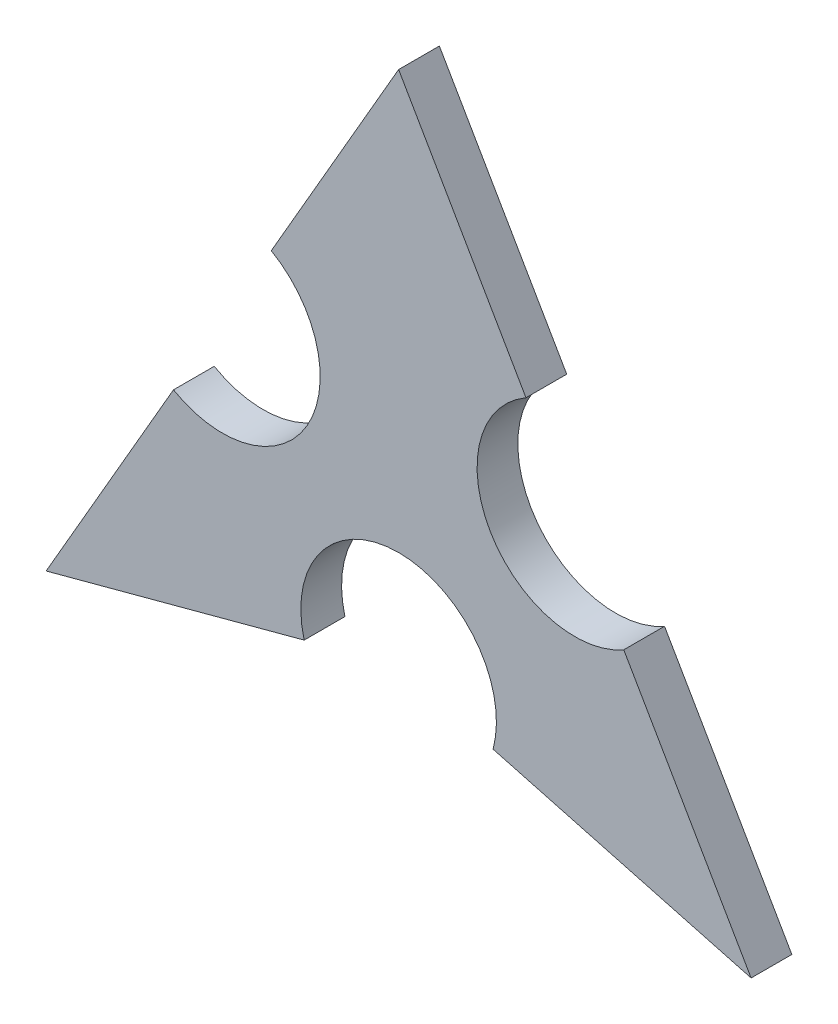
from build123d import *

# Parameters (mm, degrees)
BOSS_EXTRUDE1_DEPTH = 5


with BuildPart() as part:
    # Sketch1 → Boss-Extrude1 (new, symmetric)
    with BuildSketch(Plane.XY):
        with BuildLine():
            Line((31.25, 20.784609691), (0, 74.911197427))
            Line((0, 74.911197427), (0, -27.733592282))
            ThreePointArc((0, -27.733592282), (19.040480167, -37.123317986), (23.182219831, -57.945249365))
            Line((23.182219831, -57.945249365), (86.5, -74.911197427))
            Line((86.5, -74.911197427), (55.25, -20.784609691))
            ThreePointArc((55.25, -20.784609691), (22.465390309, -12), (31.25, 20.784609691))
        make_face()
        with BuildLine():
            Line((0, -27.733592282), (0, 74.911197427))
            Line((0, 74.911197427), (-31.25, 20.784609691))
            ThreePointArc((-31.25, 20.784609691), (-22.465390309, -12), (-55.25, -20.784609691))
            Line((-55.25, -20.784609691), (-86.5, -74.911197427))
            Line((-86.5, -74.911197427), (-23.182219831, -57.945249365))
            ThreePointArc((-23.182219831, -57.945249365), (-19.040480167, -37.123317986), (0, -27.733592282))
        make_face()
    extrude(amount=BOSS_EXTRUDE1_DEPTH, both=True)


solid = part.part
